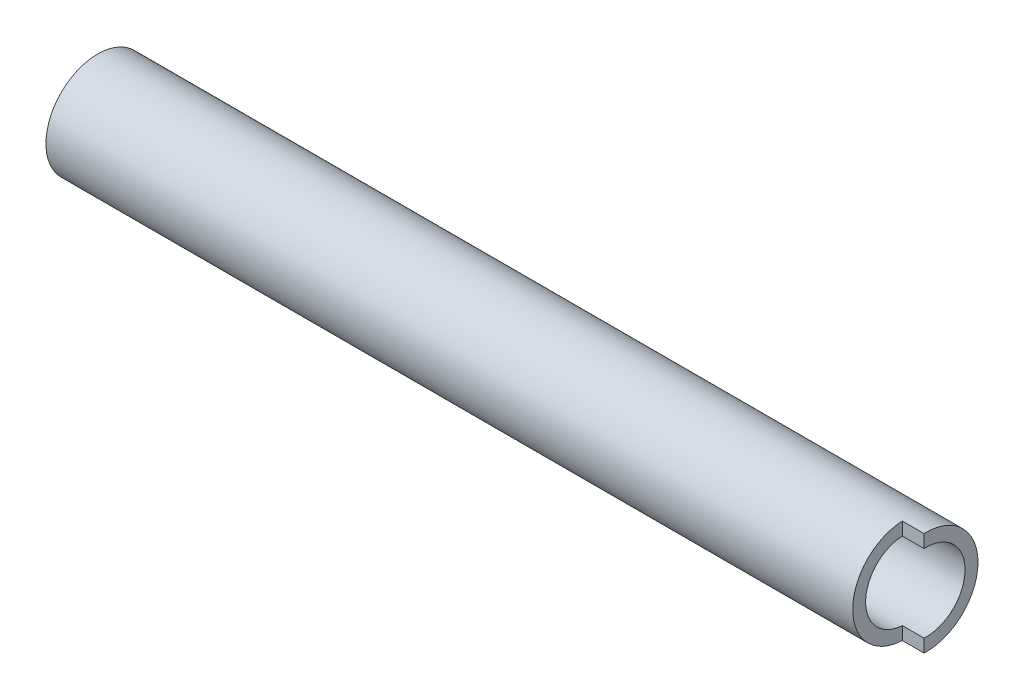
from build123d import *

# Parameters (mm, degrees)
SKETCH3_R           = 4.7625
SKETCH3_R_2         = 3.571875
BOSS_EXTRUDE1_DEPTH = 38.1
SKETCH4_W           = 4
SKETCH4_H           = 11.464180208
CUT_EXTRUDE1_DEPTH  = 34.798


with BuildPart() as part:
    # Sketch3 → Boss-Extrude1 (new, symmetric)
    with BuildSketch(Plane(origin=(0, 0, 0), x_dir=(0, 0, -1), z_dir=(1, 0, 0))):
        with Locations(Location((0, 0, 0), (0, 0, 180))):
            Circle(SKETCH3_R)
        with Locations(Location((0, 0, 0), (0, 0, 180))):
            Circle(SKETCH3_R_2, mode=Mode.SUBTRACT)
    extrude(amount=BOSS_EXTRUDE1_DEPTH, both=True)

    # Sketch4 → Cut-Extrude1 (cut)
    with BuildSketch(Plane.XY.offset(35)):
        with Locations((38.1, 0)):
            Rectangle(SKETCH4_W, SKETCH4_H)
    extrude(amount=-CUT_EXTRUDE1_DEPTH, mode=Mode.SUBTRACT)


solid = part.part
